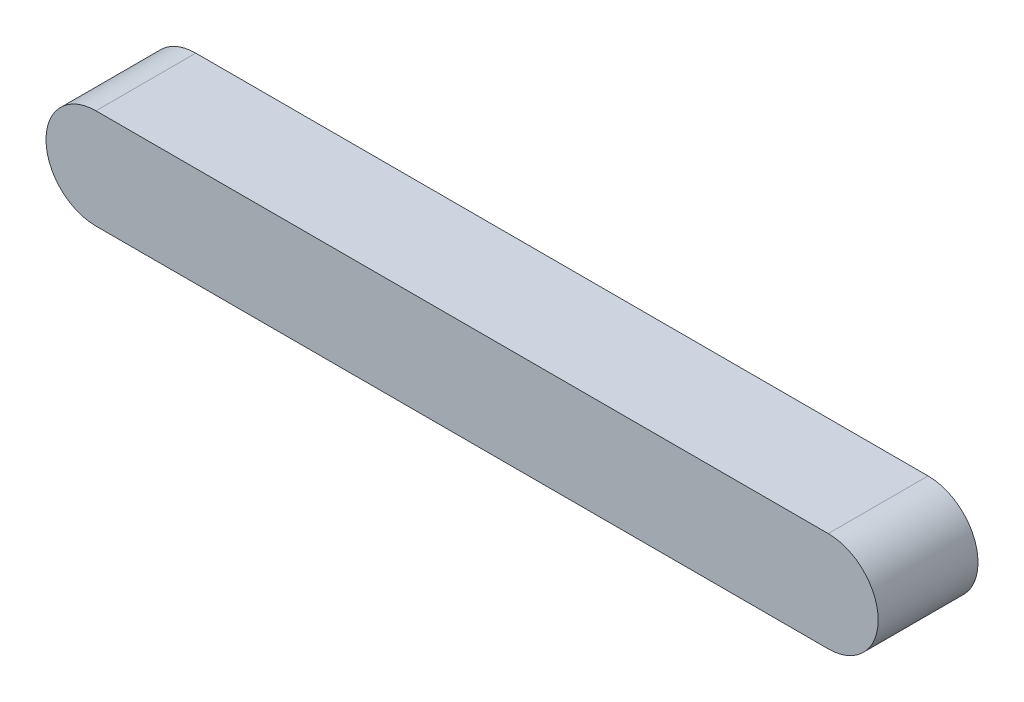
from build123d import *

# Parameters (mm, degrees)
BOSS_EXTRUDE1_DEPTH = 12


with BuildPart() as part:
    # Sketch1 → Boss-Extrude1 (new body)
    with BuildSketch(Plane.XY):
        with BuildLine():
            Line((-44, 6), (44, 6))
            ThreePointArc((44, 6), (50, 0), (44, -6))
            Line((44, -6), (-44, -6))
            ThreePointArc((-44, -6), (-50, 0), (-44, 6))
        make_face()
    extrude(amount=BOSS_EXTRUDE1_DEPTH)


solid = part.part
